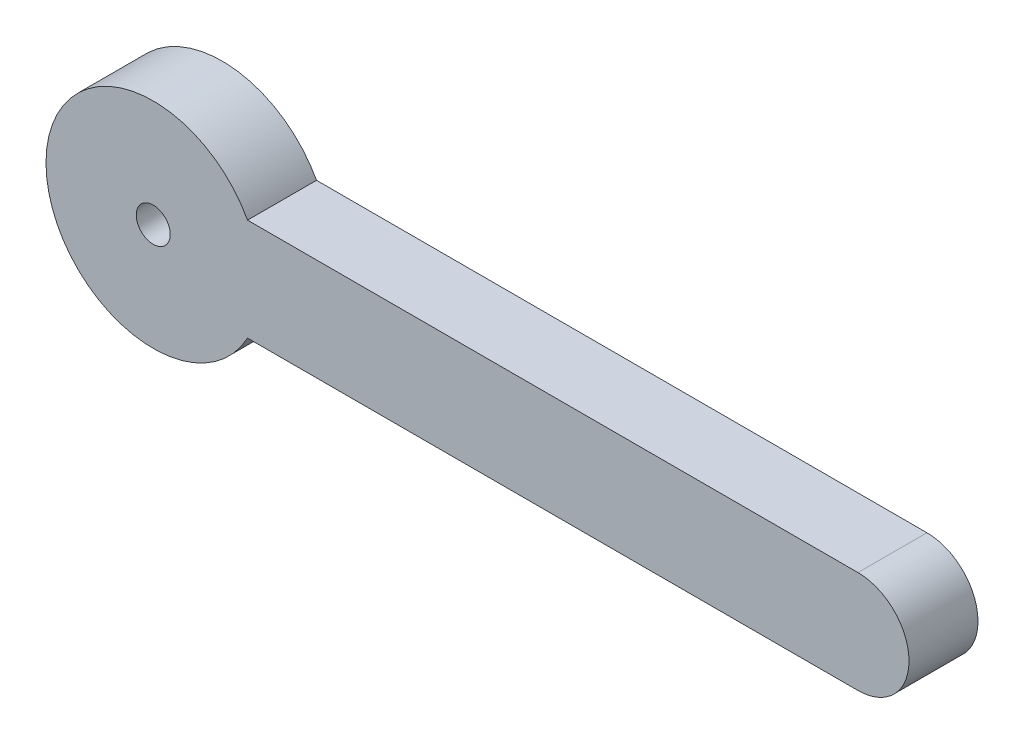
from build123d import *

# Parameters (mm, degrees)
EXTRUDE_1_DEPTH          = 10
CUT_EXTRUDE_1_DEPTH      = 112.11599651
CUT_EXTRUDE_1_DEPTH_BACK = 5
SKETCH_2_R               = 8.120196397
SKETCH_3_R               = 2.466762855
CUT_EXTRUDE_2_DEPTH      = 5


with BuildPart() as part:
    # 草图1 → 凸台-拉伸1 (new body)
    with BuildSketch(Plane.XY):
        with BuildLine():
            Line((13.670219887, 7.404471095), (102.163149927, 7.404471095))
            ThreePointArc((102.163149927, 7.404471095), (109.567621023, 0), (102.163149927, -7.404471095))
            Line((102.163149927, -7.404471095), (13.670219887, -7.404471095))
            ThreePointArc((13.670219887, -7.404471095), (-15.546739336, 0), (13.670219887, 7.404471095))
        make_face()
    extrude(amount=EXTRUDE_1_DEPTH)

    # 草图2 → 切除-拉伸1 (cut, two sides: drawn at the far end of the back side and taken through both)
    with BuildSketch(Plane(origin=(0, 0, 0), x_dir=(-1, 0, 0), z_dir=(0, 0, -1)).offset(-CUT_EXTRUDE_1_DEPTH_BACK)):
        with Locations(Location((0, 0, 0), (0, 0, 180))):
            Circle(SKETCH_2_R)
    extrude(amount=CUT_EXTRUDE_1_DEPTH + CUT_EXTRUDE_1_DEPTH_BACK, mode=Mode.SUBTRACT)

    # 草图3 → 切除-拉伸2 (cut)
    with BuildSketch(Plane.XY.offset(10)):
        Circle(SKETCH_3_R)
    extrude(amount=-CUT_EXTRUDE_2_DEPTH, mode=Mode.SUBTRACT)


solid = part.part
